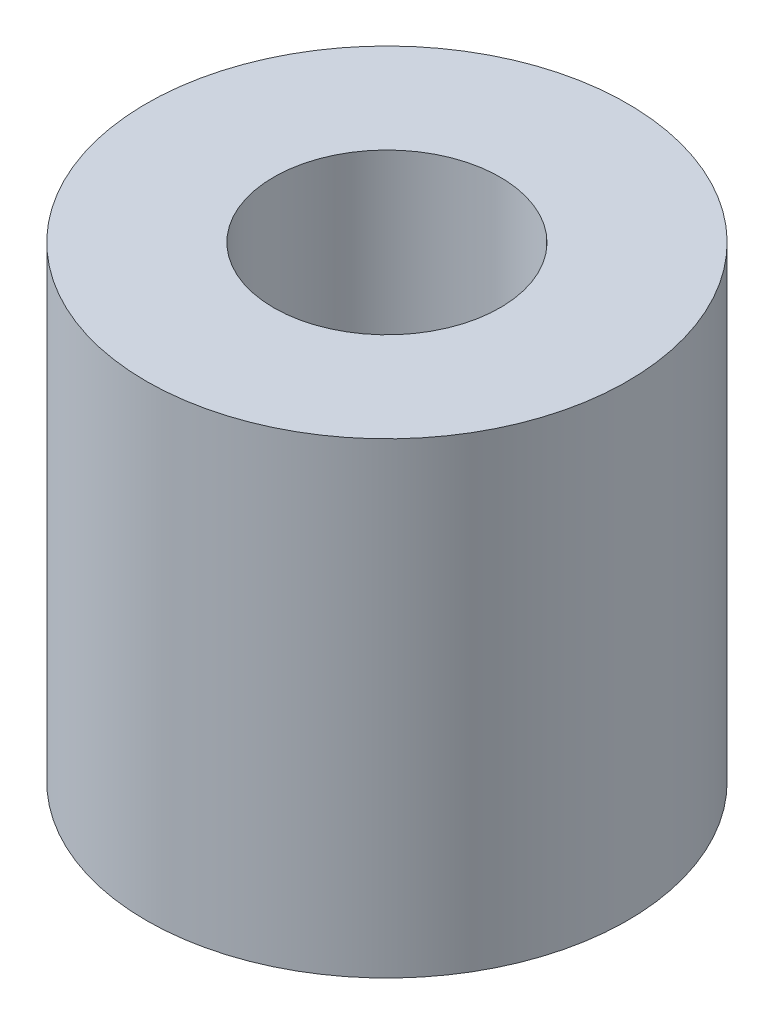
from build123d import *

# Parameters (mm, degrees)
SKETCH_1_R      = 17
SKETCH_1_R_2    = 8
EXTRUDE_1_DEPTH = 33


with BuildPart() as part:
    # 草图1 → 凸台-拉伸1 (new body)
    with BuildSketch(Plane(origin=(0, 0, 0), x_dir=(1, 0, 0), z_dir=(0, 1, 0))):
        with Locations(Location((0, 0, 0), (0, 0, 270))):
            Circle(SKETCH_1_R)
        with Locations(Location((0, 0, 0), (0, 0, 270))):
            Circle(SKETCH_1_R_2, mode=Mode.SUBTRACT)
    extrude(amount=EXTRUDE_1_DEPTH)


solid = part.part
